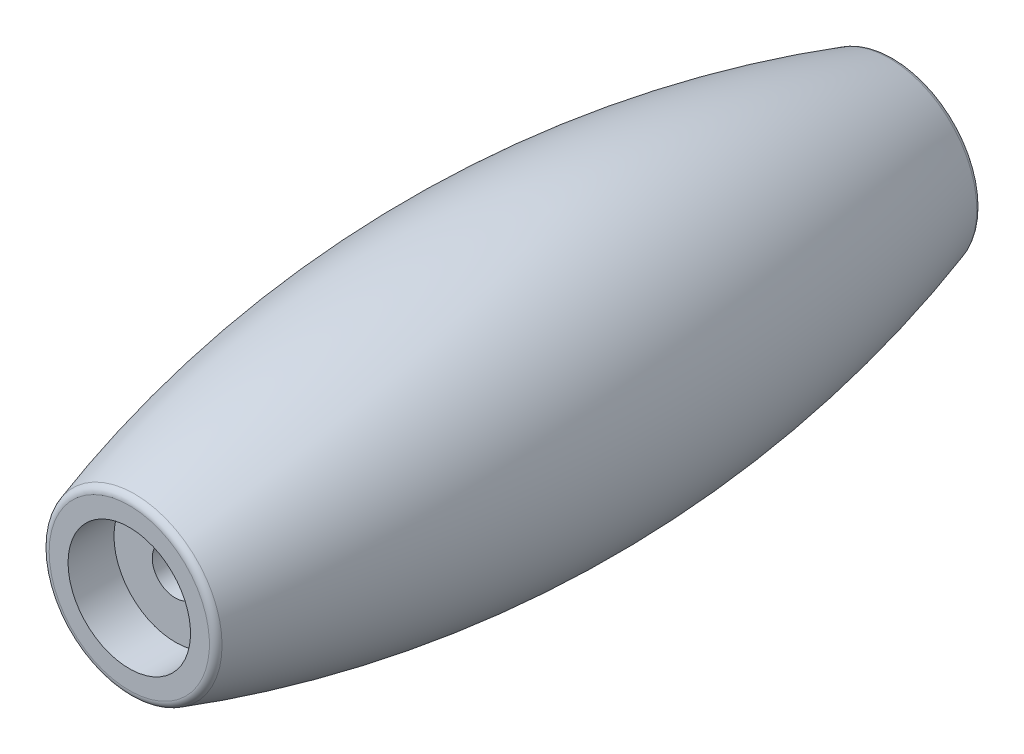
from build123d import *

# Parameters (mm, degrees)
SKETCH2_R          = 1.5
CUT_EXTRUDE1_DEPTH = 52.773545502
FILLET1_R          = 0.5


with BuildPart() as part:
    # Sketch1 → Revolve1 (revolve)
    with BuildSketch(Plane(origin=(0, 0, 0), x_dir=(1, 0, 0), z_dir=(0, 1, 0)), mode=Mode.PRIVATE) as revolve1_sk:
        with BuildLine():
            Line((0, 10.718714919), (0, -33.281285081))
            Line((0, -33.281285081), (4, -33.281285081))
            Line((4, -33.281285081), (4, -36.281285081))
            Line((4, -36.281285081), (5.6, -36.281285081))
            ThreePointArc((5.6, -36.281285081), (9.5, -11.281285081), (5.6, 13.718714919))
            Line((5.6, 13.718714919), (4, 13.718714919))
            Line((4, 13.718714919), (4, 10.718714919))
            Line((4, 10.718714919), (0, 10.718714919))
        make_face()
    revolve(revolve1_sk.sketch.rotate(Axis((0, 0, -10.718714919), (0, 0, 1)), 180), axis=Axis((0, 0, -10.718714919), (0, 0, 1)))

    # Sketch2 → Cut-Extrude1 (cut, through all)
    with BuildSketch(Plane.XY.offset(36.281285081)):
        Circle(SKETCH2_R)
    extrude(amount=-CUT_EXTRUDE1_DEPTH, mode=Mode.SUBTRACT)

    # Fillet1
    fillet1_edges = [part.edges().sort_by_distance(p)[0] for p in [
        (5.6, 0, -13.718714919),
        (5.6, 0, 36.281285081),
    ]]
    fillet(fillet1_edges, radius=FILLET1_R)


solid = part.part
